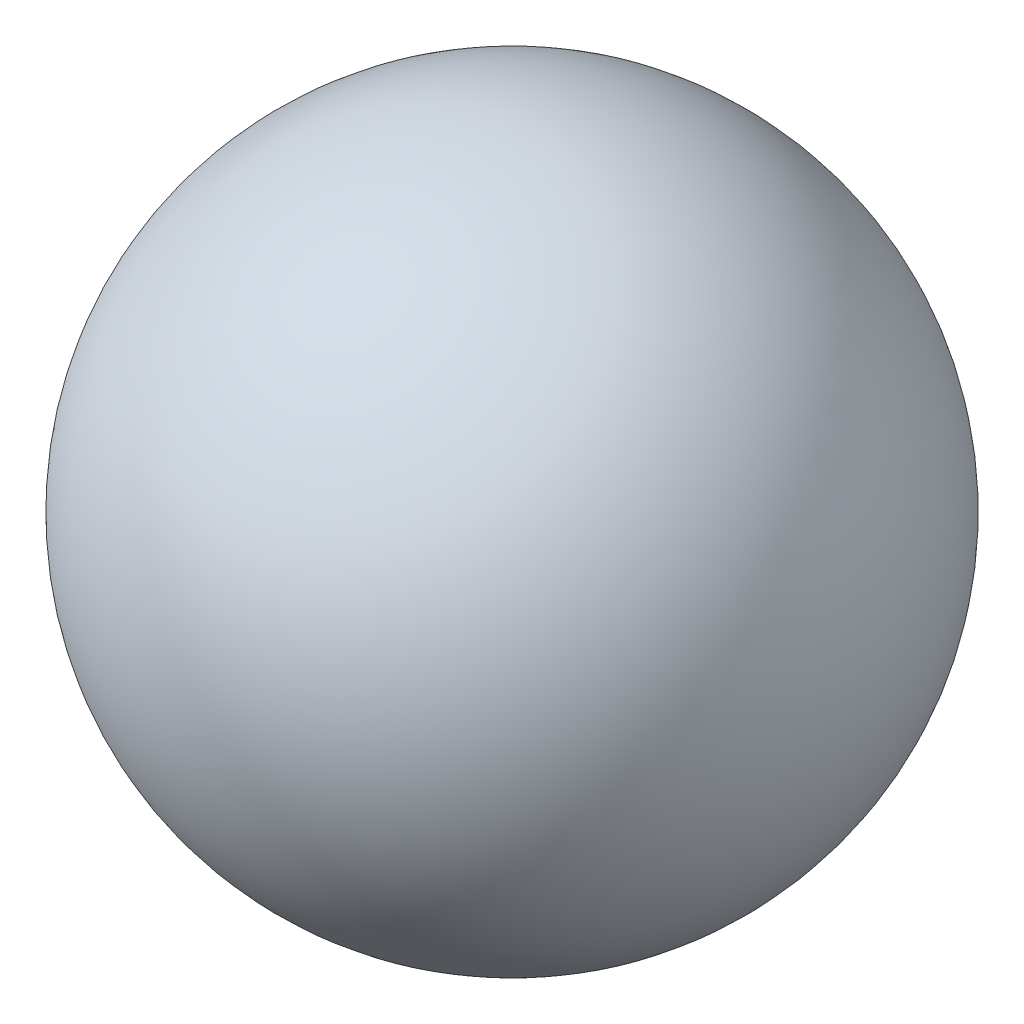
from build123d import *


with BuildPart() as part:
    # Sketch2 → Revolve1 (revolve)
    with BuildSketch(Plane.XY):
        with BuildLine():
            Line((0, 1.143), (0, -1.143))
            ThreePointArc((0, -1.143), (1.143, 0), (0, 1.143))
        make_face()
    revolve(axis=Axis((0, 1.143, 0), (0, -1, 0)))


solid = part.part
